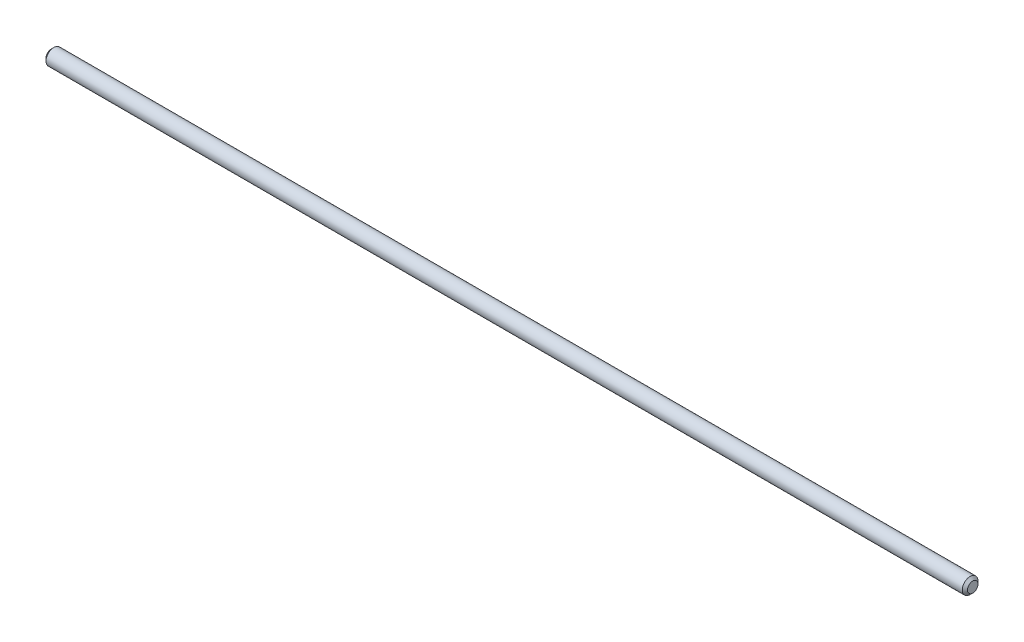
from build123d import *

# Parameters (mm, degrees)
SKETCH2_R           = 1.5
BOSS_EXTRUDE1_DEPTH = 175.5
CHAMFER1_SIZE       = 0.5


with BuildPart() as part:
    # Sketch2 → Boss-Extrude1 (new body)
    with BuildSketch(Plane(origin=(0, 0, 0), x_dir=(0, 0, -1), z_dir=(1, 0, 0))):
        Circle(SKETCH2_R)
    extrude(amount=BOSS_EXTRUDE1_DEPTH)

    # Chamfer1
    chamfer1_edges = [part.edges().sort_by_distance(p)[0] for p in [
        (0, 0, 1.5),
        (175.5, 0, 1.5),
    ]]
    chamfer(chamfer1_edges, length=CHAMFER1_SIZE)


solid = part.part
